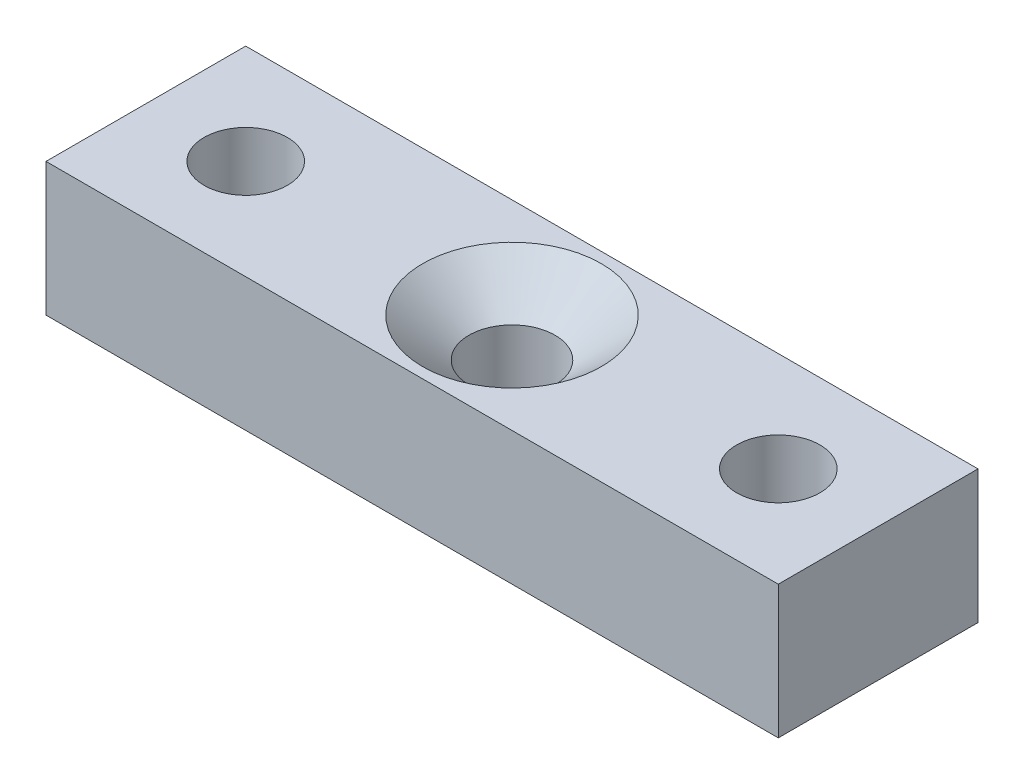
from build123d import *

# Parameters (mm, degrees)
SKETCH1_W                                           = 69.85
SKETCH1_H                                           = 12.7
BOSS_EXTRUDE1_DEPTH                                 = 19.05
F_5_16_0_3125_DIAMETER_HOLE1_D                      = 7.9375
CSK_FOR_5_16_FLAT_HEAD_MACHINE_SCREW_10_D           = 8.2042
CSK_FOR_5_16_FLAT_HEAD_MACHINE_SCREW_10_CSINK_D     = 17.0371262
CSK_FOR_5_16_FLAT_HEAD_MACHINE_SCREW_10_CSINK_ANGLE = 100


with BuildPart() as part:
    # Sketch1 → Boss-Extrude1 (new body)
    with BuildSketch(Plane.XY):
        Rectangle(SKETCH1_W, SKETCH1_H)
    extrude(amount=BOSS_EXTRUDE1_DEPTH)

    # 5/16 (0.3125) Diameter Hole1 (through all)
    with Locations(Plane(origin=(0, 6.35, 0), x_dir=(1, 0, 0), z_dir=(0, 1, 0))):
        with Locations((-25.4, -9.525), (25.4, -9.525)):
            Hole(F_5_16_0_3125_DIAMETER_HOLE1_D / 2)

    # CSK for 5/16 Flat Head Machine Screw (100)1 (through all)
    with Locations(Plane(origin=(0, 6.35, 0), x_dir=(1, 0, 0), z_dir=(0, 1, 0))):
        with Locations((0, -9.525)):
            CounterSinkHole(CSK_FOR_5_16_FLAT_HEAD_MACHINE_SCREW_10_D / 2, CSK_FOR_5_16_FLAT_HEAD_MACHINE_SCREW_10_CSINK_D / 2, counter_sink_angle=CSK_FOR_5_16_FLAT_HEAD_MACHINE_SCREW_10_CSINK_ANGLE)


solid = part.part
